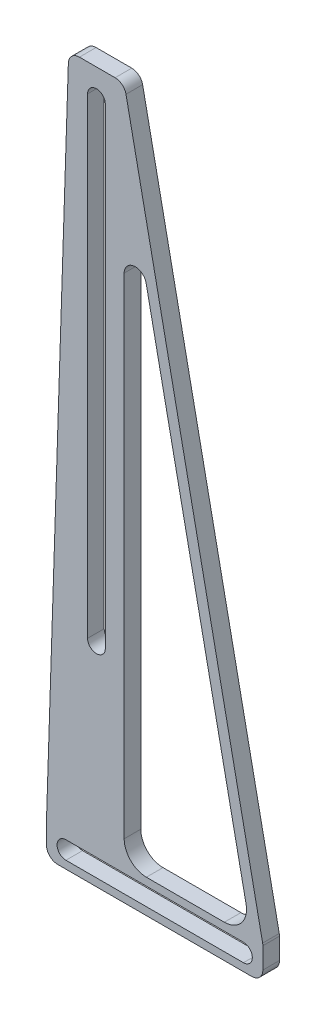
from build123d import *

# Parameters (mm, degrees)
EXTRUDE_1_DEPTH = 3
EXTRUDE_2_DEPTH = 3
FILLET_1_R      = 2
FILLET_2_R      = 4
FILLET_3_R      = 2


with BuildPart() as part:
    # 草图1 → 凸台-拉伸1 (new body)
    with BuildSketch(Plane.XY):
        Polygon((0, 0), (39, 0), (39, 6), (14, 6), (14, 128), (4, 128), (4, 6), (0, 6), align=None)
        with BuildLine():
            Line((3.5, 4.6), (35.5, 4.6))
            ThreePointArc((35.5, 4.6), (37.1, 3), (35.5, 1.4))
            Line((35.5, 1.4), (3.5, 1.4))
            ThreePointArc((3.5, 1.4), (1.9, 3), (3.5, 4.6))
        make_face(mode=Mode.SUBTRACT)
        with BuildLine():
            Line((7.4, 38), (7.4, 123))
            ThreePointArc((7.4, 123), (9, 124.6), (10.6, 123))
            Line((10.6, 123), (10.6, 38))
            ThreePointArc((10.6, 38), (9, 36.4), (7.4, 38))
        make_face(mode=Mode.SUBTRACT)
    extrude(amount=EXTRUDE_1_DEPTH)

    # 草图2 → 凸台-拉伸2 (add)
    with BuildSketch(Plane.XY.offset(3)):
        Polygon((0, 6), (4, 128), (4, 6), align=None)
        Polygon((14, 128), (39, 6), (36.9584404, 6), (14, 118.037189152), align=None)
    extrude(amount=-EXTRUDE_2_DEPTH)

    # 圆角1
    fillet_1_edges = [part.edges().sort_by_distance(p)[0] for p in [
        (0, 6, 1.5),
        (4, 128, 1.5),
        (14, 128, 1.5),
        (39, 6, 1.5),
        (14, 118.037189152, 1.5),
    ]]
    fillet(fillet_1_edges, radius=FILLET_1_R)

    # 圆角2
    fillet_2_edges = [part.edges().sort_by_distance(p)[0] for p in [
        (14, 6, 1.5),
        (36.9584404, 6, 1.5),
    ]]
    fillet(fillet_2_edges, radius=FILLET_2_R)

    # 圆角3
    fillet_3_edges = [part.edges().sort_by_distance(p)[0] for p in [
        (39, 0, 1.5),
        (0, 0, 1.5),
    ]]
    fillet(fillet_3_edges, radius=FILLET_3_R)


solid = part.part
